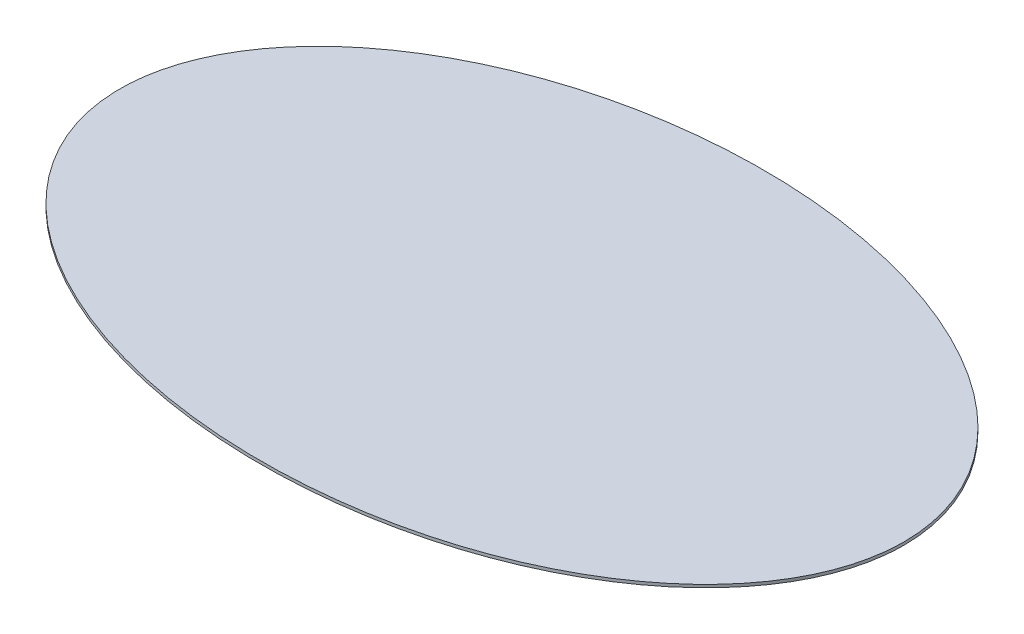
from build123d import *

# Parameters (mm, degrees)
ESQUISSE1_RX       = 6.7
ESQUISSE1_RY       = 4.3
BOSS_EXTRU_1_DEPTH = 0.05


with BuildPart() as part:
    # Esquisse1 → Boss.-Extru.1 (new body)
    with BuildSketch(Plane(origin=(0, 0, 0), x_dir=(1, 0, 0), z_dir=(0, 1, 0))):
        with Locations((0, 0)):
            Ellipse(ESQUISSE1_RX, ESQUISSE1_RY)
    extrude(amount=BOSS_EXTRU_1_DEPTH)


solid = part.part
